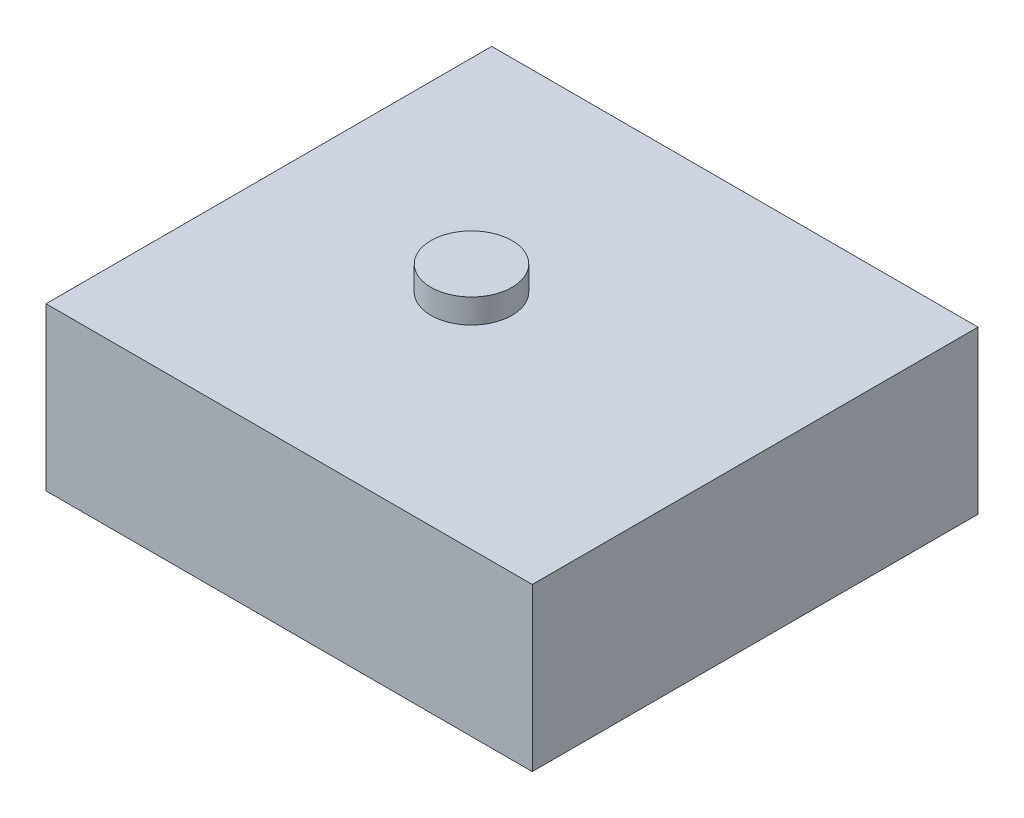
from build123d import *

# Parameters (mm, degrees)
SKETCH1_W           = 120
SKETCH1_H           = 110
BOSS_EXTRUDE1_DEPTH = 40
SKETCH2_R           = 10
BOSS_EXTRUDE2_DEPTH = 6


with BuildPart() as part:
    # Sketch1 → Boss-Extrude1 (new body)
    with BuildSketch(Plane(origin=(0, 0, 0), x_dir=(1, 0, 0), z_dir=(0, 1, 0))):
        Rectangle(SKETCH1_W, SKETCH1_H)
    extrude(amount=BOSS_EXTRUDE1_DEPTH)

    # Sketch2 → Boss-Extrude2 (add)
    with BuildSketch(Plane(origin=(0, 40, 0), x_dir=(1, 0, 0), z_dir=(0, 1, 0))):
        with Locations(Location((-10, 0, 0), (0, 0, 270))):
            Circle(SKETCH2_R)
    extrude(amount=BOSS_EXTRUDE2_DEPTH)


solid = part.part
